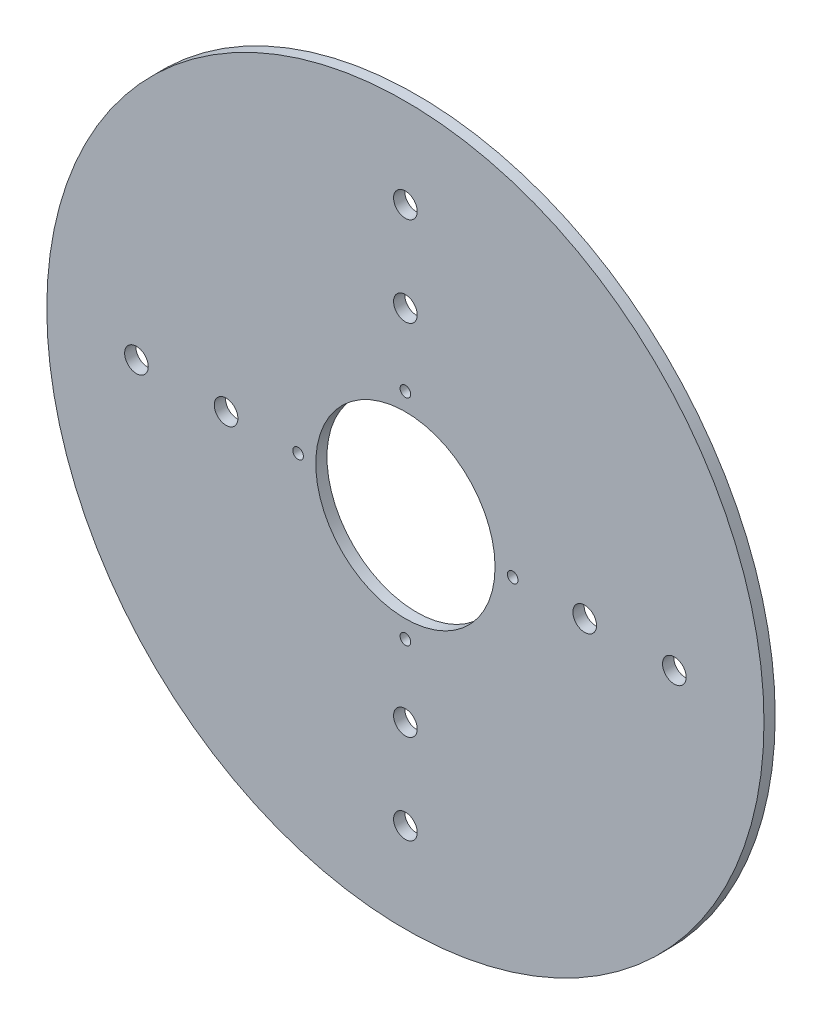
from build123d import *

# Parameters (mm, degrees)
SKETCH1_R           = 101.6
BOSS_EXTRUDE1_DEPTH = 3.175
SKETCH2_R           = 25.4
CUT_EXTRUDE1_DEPTH  = 3.175
SKETCH4_R           = 1.5
CUT_EXTRUDE3_DEPTH  = 10
SKETCH5_R           = 3.35
CUT_EXTRUDE4_DEPTH  = 10
SKETCH6_R           = 3.35
CUT_EXTRUDE5_DEPTH  = 10


with BuildPart() as part:
    # Sketch1 → Boss-Extrude1 (new body)
    with BuildSketch(Plane.XY):
        Circle(SKETCH1_R)
    extrude(amount=BOSS_EXTRUDE1_DEPTH)

    # Sketch2 → Cut-Extrude1 (cut)
    with BuildSketch(Plane.XY.offset(3.175)):
        Circle(SKETCH2_R)
    extrude(amount=-CUT_EXTRUDE1_DEPTH, mode=Mode.SUBTRACT)

    # Sketch4 → Cut-Extrude3 (cut)
    with BuildSketch(Plane(origin=(0, 0, 0), x_dir=(-1, 0, 0), z_dir=(0, 0, -1))):
        with Locations((0, 30.399999906)):
            Circle(SKETCH4_R)
        with Locations((30.399999906, 0)):
            Circle(SKETCH4_R)
        with Locations((0, -30.399999906)):
            Circle(SKETCH4_R)
        with Locations((-30.399999906, 0)):
            Circle(SKETCH4_R)
    extrude(amount=-CUT_EXTRUDE3_DEPTH, mode=Mode.SUBTRACT)

    # Sketch5 → Cut-Extrude4 (cut)
    with BuildSketch(Plane(origin=(0, 0, 0), x_dir=(-1, 0, 0), z_dir=(0, 0, -1))):
        with Locations((0, 50.8)):
            Circle(SKETCH5_R)
        with Locations((50.8, 0)):
            Circle(SKETCH5_R)
        with Locations((0, -50.8)):
            Circle(SKETCH5_R)
        with Locations((-50.8, 0)):
            Circle(SKETCH5_R)
    extrude(amount=-CUT_EXTRUDE4_DEPTH, mode=Mode.SUBTRACT)

    # Sketch6 → Cut-Extrude5 (cut)
    with BuildSketch(Plane(origin=(0, 0, 0), x_dir=(-1, 0, 0), z_dir=(0, 0, -1))):
        with Locations((-76.2, 0)):
            Circle(SKETCH6_R)
        with Locations((0, 76.2)):
            Circle(SKETCH6_R)
        with Locations((0, -76.2)):
            Circle(SKETCH6_R)
        with Locations((76.2, 0)):
            Circle(SKETCH6_R)
    extrude(amount=-CUT_EXTRUDE5_DEPTH, mode=Mode.SUBTRACT)


solid = part.part
